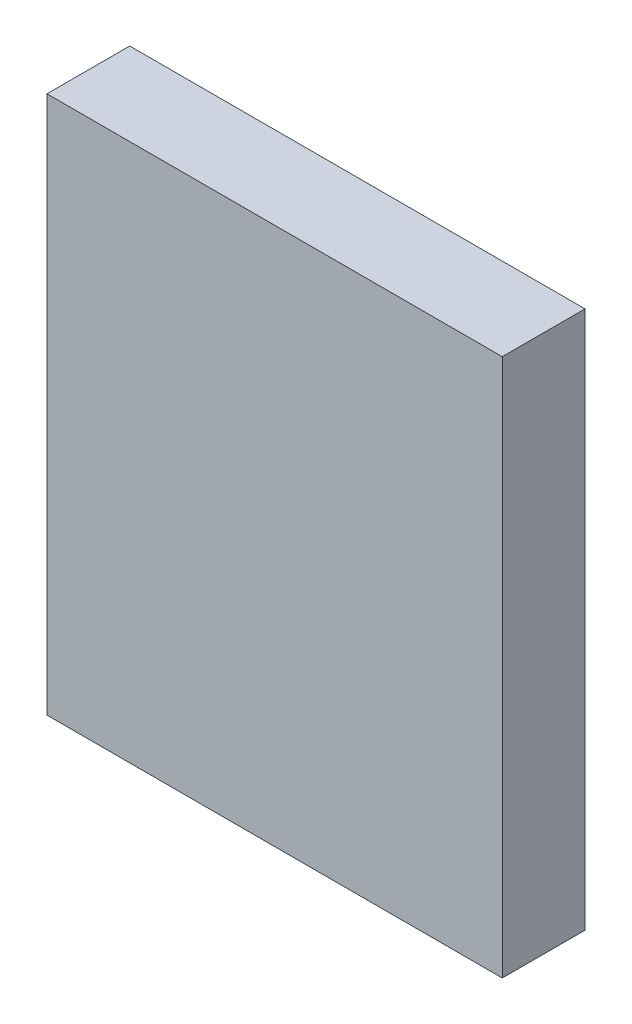
from build123d import *

# Parameters (mm, degrees)
ESQUISSE1_W        = 69.85
ESQUISSE1_H        = 82.55
BOSS_EXTRU_1_DEPTH = 12.7


with BuildPart() as part:
    # Esquisse1 → Boss.-Extru.1 (new body)
    with BuildSketch(Plane.XY):
        Rectangle(ESQUISSE1_W, ESQUISSE1_H)
    extrude(amount=BOSS_EXTRU_1_DEPTH)


solid = part.part
